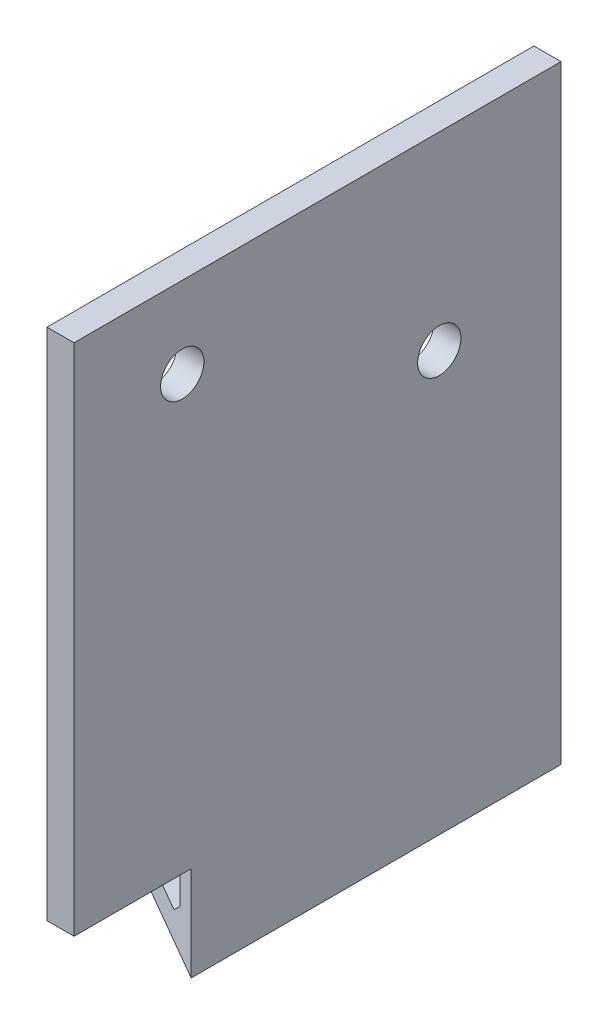
from build123d import *

# Parameters (mm, degrees)
EXTRUDE_2_DEPTH     = 36
CUT_EXTRUDE_4_REACH = 61.548
SKETCH_7_R          = 1.5
CHAMFER_2_SIZE      = 1
CUT_EXTRUDE_5_REACH = 61.548
SKETCH_8_R          = 1.6
CUT_EXTRUDE_6_REACH = 60.052
CUT_EXTRUDE_8_DEPTH = 5


with BuildPart() as part:
    # ｽｹｯﾁ6 → ﾎﾞｽ - 押し出し2 (new body)
    with BuildSketch(Plane.XY):
        Polygon((0, 0), (15, 0), (15, 45), (13, 45), (13, 2), (0, 2), align=None)
    extrude(amount=EXTRUDE_2_DEPTH)

    # ｽｹｯﾁ7 → ｶｯﾄ - 押し出し4 (cut, up to next)
    with BuildSketch(Plane.XZ, mode=Mode.PRIVATE) as cut_extrude_4_sk1:
        with Locations(Location((7.5, 18, 0), (0, 0, 270))):
            Circle(SKETCH_7_R)
    cut_extrude_4_tool1 = extrude(cut_extrude_4_sk1.sketch, amount=-CUT_EXTRUDE_4_REACH, mode=Mode.PRIVATE) & part.part
    # ｽｹｯﾁ7 → ｶｯﾄ - 押し出し4 (cut, up to next)
    with BuildSketch(Plane.XZ, mode=Mode.PRIVATE) as cut_extrude_4_sk2:
        with Locations(Location((7.5, 8, 0), (0, 0, 270))):
            Circle(SKETCH_7_R)
    cut_extrude_4_tool2 = extrude(cut_extrude_4_sk2.sketch, amount=-CUT_EXTRUDE_4_REACH, mode=Mode.PRIVATE) & part.part
    add(cut_extrude_4_tool1.solids().sort_by_distance((7.5, 0, 18))[0], mode=Mode.SUBTRACT)
    add(cut_extrude_4_tool2.solids().sort_by_distance((7.5, 0, 8))[0], mode=Mode.SUBTRACT)

    # 面取り2
    chamfer_2_edges = [part.edges().sort_by_distance(p)[0] for p in [
        (13, 2, 18),
    ]]
    chamfer(chamfer_2_edges, length=CHAMFER_2_SIZE)

    # ｽｹｯﾁ8 → ｶｯﾄ - 押し出し5 (cut, up to next)
    with BuildSketch(Plane(origin=(15, 0, 0), x_dir=(0, 0, -1), z_dir=(1, 0, 0)), mode=Mode.PRIVATE) as cut_extrude_5_sk1:
        with Locations((-28, 39)):
            Circle(SKETCH_8_R)
    cut_extrude_5_tool1 = extrude(cut_extrude_5_sk1.sketch, amount=-CUT_EXTRUDE_5_REACH, mode=Mode.PRIVATE) & part.part
    # ｽｹｯﾁ8 → ｶｯﾄ - 押し出し5 (cut, up to next)
    with BuildSketch(Plane(origin=(15, 0, 0), x_dir=(0, 0, -1), z_dir=(1, 0, 0)), mode=Mode.PRIVATE) as cut_extrude_5_sk2:
        with Locations((-9, 31)):
            Circle(SKETCH_8_R)
    cut_extrude_5_tool2 = extrude(cut_extrude_5_sk2.sketch, amount=-CUT_EXTRUDE_5_REACH, mode=Mode.PRIVATE) & part.part
    add(cut_extrude_5_tool1.solids().sort_by_distance((15, 39, 28))[0], mode=Mode.SUBTRACT)
    add(cut_extrude_5_tool2.solids().sort_by_distance((15, 31, 9))[0], mode=Mode.SUBTRACT)

    # ｽｹｯﾁ9 → ｶｯﾄ - 押し出し6 (cut, up to next)
    with BuildSketch(Plane(origin=(0, 2, 0), x_dir=(1, 0, 0), z_dir=(0, 1, 0)), mode=Mode.PRIVATE) as cut_extrude_6_sk1:
        Polygon((0, -36), (30, -36), (0, -18.679491924), align=None)
    cut_extrude_6_tool1 = extrude(cut_extrude_6_sk1.sketch, amount=-CUT_EXTRUDE_6_REACH, mode=Mode.PRIVATE) & part.part
    add(cut_extrude_6_tool1.solids().sort_by_distance((10, 2, 30.226497))[0], mode=Mode.SUBTRACT)

    # ｽｹｯﾁ11 → ｶｯﾄ - 押し出し8 (cut)
    with BuildSketch(Plane.XZ.offset(-2)):
        Polygon((12, 25.607695155), (15, 27.339745962), (15, 36), (12, 36), align=None)
    extrude(amount=-CUT_EXTRUDE_8_DEPTH, mode=Mode.SUBTRACT)


solid = part.part
